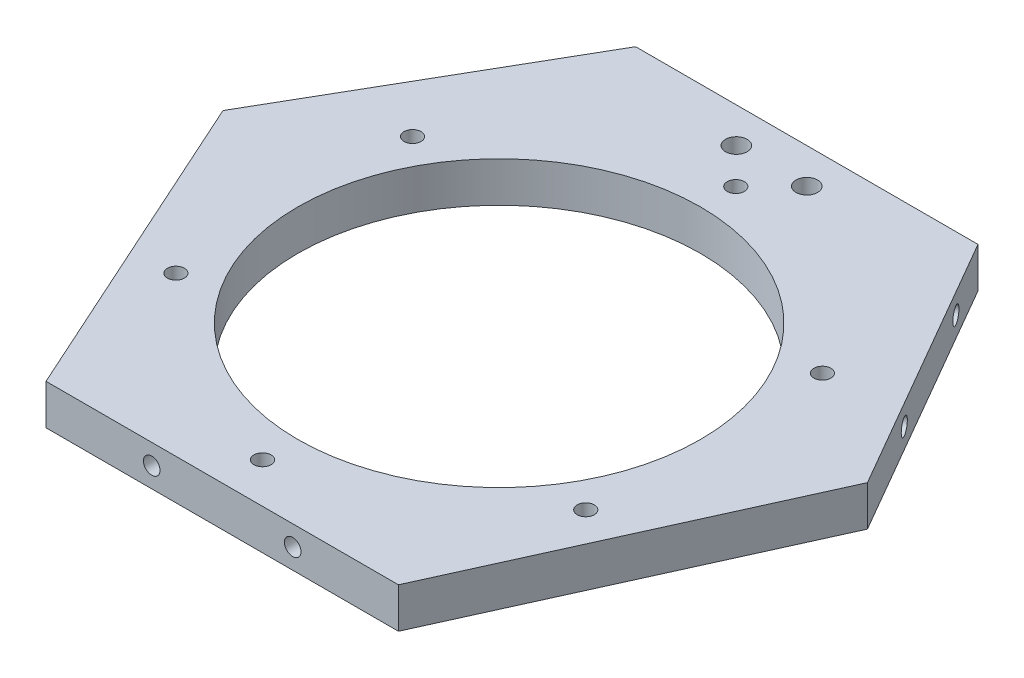
from build123d import *

# Parameters (mm, degrees)
SKETCH_2_R                  = 40
EXTRUDE_1_DEPTH             = 4
HOLE_WIZARD_M3_1_D          = 3.4
HOLE_WIZARD_M4_1_AT_2_COUNT = 2
HOLE_WIZARD_M4_1_AT_2_PITCH = 28
HOLE_WIZARD_M4_3_D          = 3.3
HOLE_WIZARD_M4_3_DEPTH      = 15
HOLE_WIZARD_M4_3_TIP        = 0.991420021
HOLE_WIZARD_M4_1_2_D        = 4.3


with BuildPart() as part:
    # 草图2 → 凸台-拉伸1 (new, symmetric)
    with BuildSketch(Plane(origin=(0, 0, 0), x_dir=(1, 0, 0), z_dir=(0, 1, 0))):
        Polygon((34, 61.110272543), (-34, 61.110272543), (-64, 9.148748316), (-35, -55), (35, -55), (64, 9.148748316), align=None)
        Circle(SKETCH_2_R, mode=Mode.SUBTRACT)
    extrude(amount=EXTRUDE_1_DEPTH, both=True)

    # M3 间隙孔1 (through all)
    with Locations(Plane(origin=(0, 4, 0), x_dir=(1, 0, 0), z_dir=(0, 1, 0))):
        with Locations((0, 47), (40.703193978, 23.5), (40.703193978, -23.5), (0, -47), (-40.703193978, -23.5), (-40.703193978, 23.5)):
            Hole(HOLE_WIZARD_M3_1_D / 2)

    # 草图7 → Hole Wizard M4 _1 (revolve, cut)
    with BuildSketch(Plane(origin=(40, 0, -50.717967697), x_dir=(-0.49999999999999784, 0, -0.8660254037844399), z_dir=(0, 1, 0))):
        Polygon((0, 0), (0, 12.991420021), (1.65, 12), (1.65, 0), align=None)
    hole_wizard_m4_1 = revolve(axis=Axis((45.499261314, 0, -53.892967697), (-0.8660254037844399, 0, 0.49999999999999784)), mode=Mode.SUBTRACT)

    # Hole Wizard M4 _1 at 2: Hole Wizard M4 _1 ×2
    with Locations(*[Vector(0.4999999999999979, 0, 0.8660254037844399) * (i * HOLE_WIZARD_M4_1_AT_2_PITCH) for i in range(1, HOLE_WIZARD_M4_1_AT_2_COUNT)]):
        add(hole_wizard_m4_1, mode=Mode.SUBTRACT)

    # 镜向1: Hole Wizard M4 _1 across plane
    add(hole_wizard_m4_1.mirror(Plane(origin=(0, 0, 0), x_dir=(0, 0, 1), z_dir=(1, 0, 0))), mode=Mode.SUBTRACT)

    # 镜向1 copy 1 sketch → 镜向1 copy 1 (revolve, cut)
    with BuildSketch(Plane(origin=(-54, 0, -26.469256391), x_dir=(0.49999999999999784, 0, -0.8660254037844399), z_dir=(0, 1, 0))):
        Polygon((0, 0), (0, -12.991420021), (1.65, -12), (1.65, 0), align=None)
    revolve(axis=Axis((-59.499261314, 0, -29.644256391), (-0.8660254037844399, 0, -0.49999999999999784)), mode=Mode.SUBTRACT)

    # M4 螺纹孔3
    with Locations(Plane.XY.offset(55)):
        with Locations((14, 0), (-14, 0)):
            Hole(HOLE_WIZARD_M4_3_D / 2, depth=HOLE_WIZARD_M4_3_DEPTH)
            with Locations((0, 0, -(HOLE_WIZARD_M4_3_DEPTH + HOLE_WIZARD_M4_3_TIP / 2))):  # 118° drill point
                Cone(0, HOLE_WIZARD_M4_3_D / 2, HOLE_WIZARD_M4_3_TIP, mode=Mode.SUBTRACT)

    # Hole Wizard M4 _1 2 (through all)
    with Locations(Plane(origin=(0, 4, 0), x_dir=(1, 0, 0), z_dir=(0, 1, 0))):
        with Locations((-7, 54.110272543), (7, 54.110272543)):
            Hole(HOLE_WIZARD_M4_1_2_D / 2)


solid = part.part
